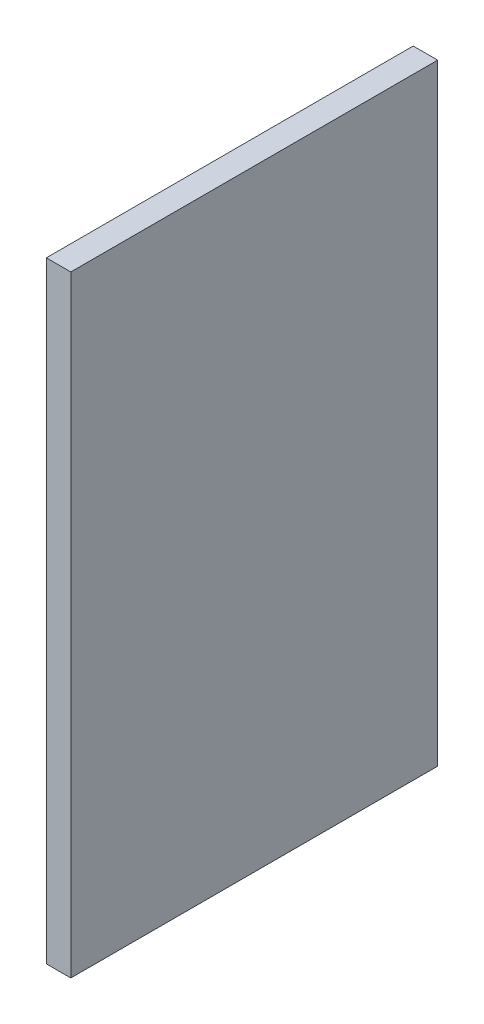
from build123d import *

# Parameters (mm, degrees)
MATING_PATCH_20X12X0P8_DEPTH      = 10
MATING_PATCH_20X12X0P8_DEPTH_BACK = 10
SKETCH_1_W                        = 0.8
SKETCH_1_H                        = 12


with BuildPart() as part:
    # 草图1 → Mating_patch_20x12x0p8 (new, two sides: drawn at the far end of the back side and taken through both)
    with BuildSketch(Plane(origin=(0, 0, 0), x_dir=(1, 0, 0), z_dir=(0, 1, 0)).offset(-MATING_PATCH_20X12X0P8_DEPTH_BACK)):
        with Locations((-109.6, -32)):
            Rectangle(SKETCH_1_W, SKETCH_1_H)
    extrude(amount=MATING_PATCH_20X12X0P8_DEPTH + MATING_PATCH_20X12X0P8_DEPTH_BACK)


solid = part.part
